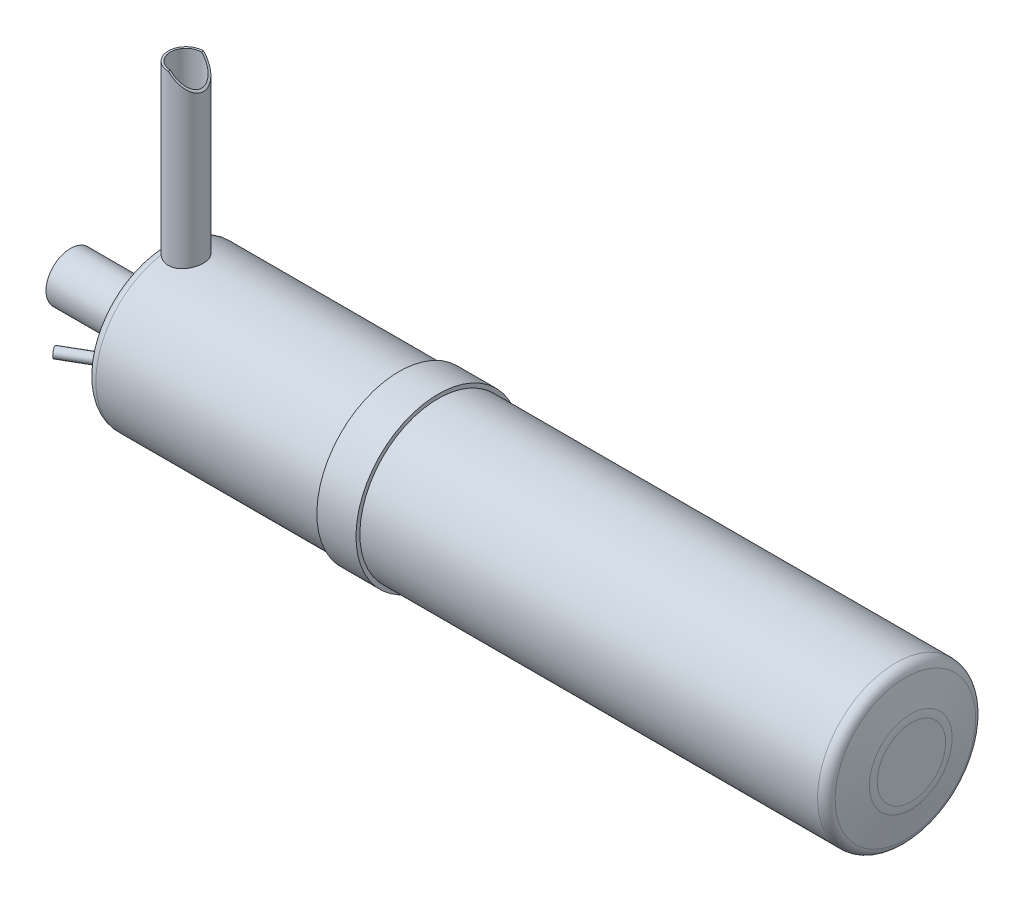
from build123d import *

# Parameters (mm, degrees)
SKETCH2_W          = 1
SKETCH2_H          = 88
CUT_EXTRUDE1_DEPTH = 10


with BuildPart() as part:
    # Sketch1 → Revolve1 (revolve)
    with BuildSketch(Plane.XY, mode=Mode.PRIVATE) as revolve1_sk:
        with BuildLine():
            Line((0, 12.5), (45, 12.5))
            Line((45, 12.5), (45, 15.837070498))
            ThreePointArc((45, 15.837070498), (45.068776959, 17.494281438), (45.27463481, 19.140094585))
            Line((45.27463481, 19.140094585), (48.068658702, 35.825756022))
            ThreePointArc((48.068658702, 35.825756022), (49.769580531, 38.816332016), (53, 40))
            Line((53, 40), (168, 40))
            Line((168, 40), (168, 42))
            Line((168, 42), (188, 42))
            Line((188, 42), (188, 40))
            Line((188, 40), (422, 40))
            ThreePointArc((422, 40), (425.195681655, 38.845467301), (426.915555723, 35.915047504))
            Line((426.915555723, 35.915047504), (429.662222892, 21.160190017))
            ThreePointArc((429.662222892, 21.160190017), (429.915376695, 19.337871346), (430, 17.5))
            Line((430, 17.5), (430, 0))
            Line((430, 0), (428, 0))
            Line((428, 0), (428, 17.5))
            ThreePointArc((428, 17.5), (427.923839026, 19.154084211), (427.696000602, 20.794171015))
            Line((427.696000602, 20.794171015), (424.949333434, 35.549028503))
            ThreePointArc((424.949333434, 35.549028503), (423.917408993, 37.30728038), (422, 38))
            Line((422, 38), (53, 38))
            ThreePointArc((53, 38), (51.061748319, 37.289799209), (50.041195221, 35.495453613))
            Line((50.041195221, 35.495453613), (47.247171329, 18.809792177))
            ThreePointArc((47.247171329, 18.809792177), (47.061899263, 17.328560344), (47, 15.837070498))
            Line((47, 15.837070498), (47, 10.5))
            Line((47, 10.5), (0, 10.5))
            Line((0, 10.5), (0, 12.5))
        make_face()
    revolve(revolve1_sk.sketch.rotate(Axis((0, 0, 0), (1, 0, 0)), 180), axis=Axis((0, 0, 0), (1, 0, 0)))

    # Sketch2 → Revolve2 (revolve)
    with BuildSketch(Plane.XY, mode=Mode.PRIVATE) as revolve2_sk:
        with Locations((50.568658702, 81)):
            Rectangle(SKETCH2_W, SKETCH2_H)
    revolve(revolve2_sk.sketch.rotate(Axis((59.068658702, 37, 0), (0, 1, 0)), 270), axis=Axis((59.068658702, 37, 0), (0, 1, 0)))

    # Sketch3 → Cut-Extrude1 (cut, symmetric)
    with BuildSketch(Plane.XY):
        Polygon((59.068658702, 125), (68.068658702, 125), (68.068658702, 116), align=None)
    extrude(amount=CUT_EXTRUDE1_DEPTH, both=True, mode=Mode.SUBTRACT)

    # Sketch4 → Revolve3 (revolve)
    with BuildSketch(Plane(origin=(0, 0, 0), x_dir=(1, 0, 0), z_dir=(0, 1, 0))):
        Polygon((49.153697564, -27.781963409), (30.101138681, -38.781963409), (30.601138681, -39.647988813), (49.653697564, -28.647988813), align=None)
    revolve(axis=Axis((29.351138681, 0, 37.482925303), (0.8660254037844377, 0, -0.5000000000000018)))


solid = part.part
